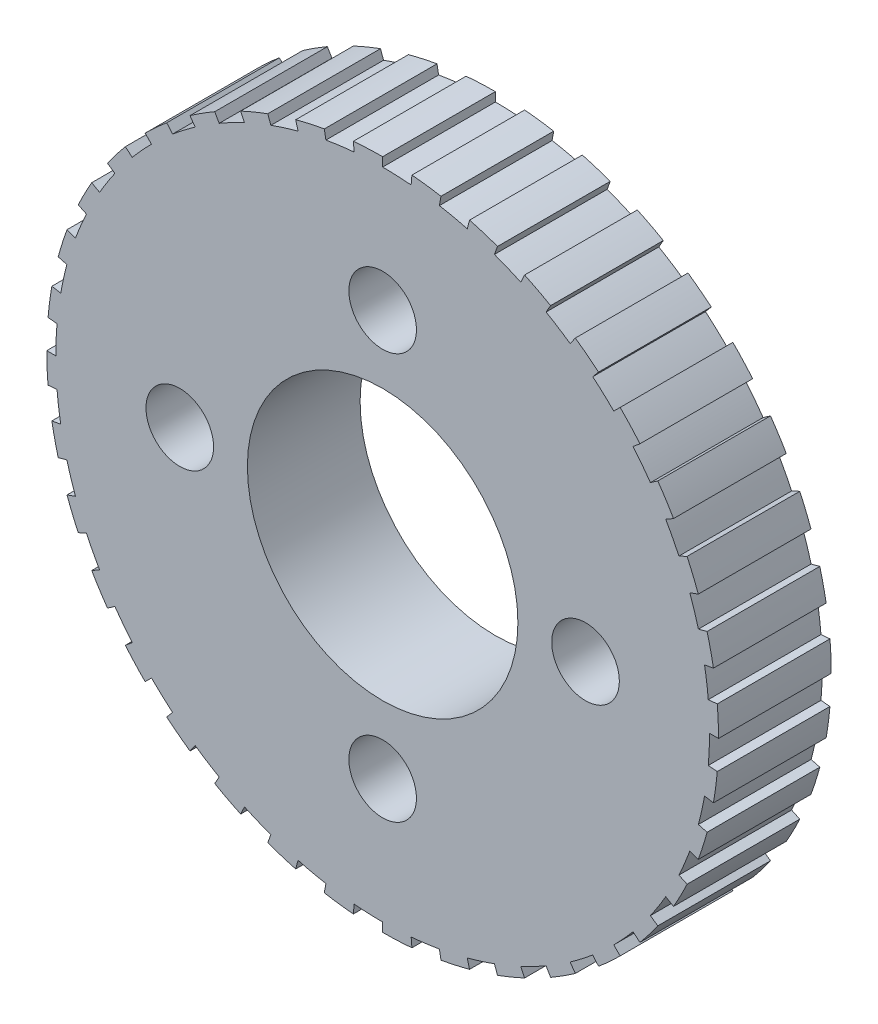
from build123d import *

# Parameters (mm, degrees)
EXTRUDE_1_DEPTH          = 5
EXTRUDE_1_DEPTH_BACK     = 5
SKETCH_1_R               = 12
CUT_EXTRUDE_1_DEPTH      = 10
CUT_EXTRUDE_1_DEPTH_BACK = 10
SKETCH_2_R               = 3


with BuildPart() as part:
    # 草图1 → 凸台-拉伸1 (new, two sides: drawn at the far end of the back side and taken through both)
    with BuildSketch(Plane.XY.offset(-EXTRUDE_1_DEPTH_BACK)):
        with BuildLine():
            Line((28.559424837, -5.035797152), (29.34727104, -5.174715694))
            ThreePointArc((29.34727104, -5.174715694), (29.545056869, -3.889680528), (29.686602003, -2.597241134))
            Line((29.686602003, -2.597241134), (28.889646245, -2.52751654))
            ThreePointArc((28.889646245, -2.52751654), (28.972398426, -1.264962234), (29, 0))
            Line((29, 0), (29.8, 0))
            ThreePointArc((29.8, 0), (29.771637003, 1.299857743), (29.686602003, 2.597241134))
            Line((29.686602003, 2.597241134), (28.889646245, 2.52751654))
            ThreePointArc((28.889646245, 2.52751654), (28.75190098, 3.785259574), (28.559424837, 5.035797152))
            Line((28.559424837, 5.035797152), (29.34727104, 5.174715694))
            ThreePointArc((29.34727104, 5.174715694), (29.093621012, 6.449900495), (28.784589623, 7.712807544))
            Line((28.784589623, 7.712807544), (28.011848962, 7.505752308))
            ThreePointArc((28.011848962, 7.505752308), (27.657791572, 8.720468186), (27.251086003, 9.918584156))
            Line((27.251086003, 9.918584156), (28.002840099, 10.192200271))
            ThreePointArc((28.002840099, 10.192200271), (27.531610069, 11.403966284), (27.007972054, 12.5940242))
            Line((27.007972054, 12.5940242), (26.282925824, 12.25592959))
            ThreePointArc((26.282925824, 12.25592959), (25.723314162, 13.390709784), (25.11473671, 14.5))
            Line((25.11473671, 14.5), (25.807557033, 14.9))
            ThreePointArc((25.807557033, 14.9), (25.133065085, 16.011528329), (24.41073092, 17.092577803))
            Line((24.41073092, 17.092577803), (23.755409284, 16.633716654))
            ThreePointArc((23.755409284, 16.633716654), (23.007246868, 17.654081441), (22.21528885, 18.640840681))
            Line((22.21528885, 18.640840681), (22.828124405, 19.155070769))
            ThreePointArc((22.828124405, 19.155070769), (21.970864637, 20.132588187), (21.071782079, 21.071782079))
            Line((21.071782079, 21.071782079), (20.506096654, 20.506096654))
            ThreePointArc((20.506096654, 20.506096654), (19.592116021, 21.381042767), (18.640840681, 22.21528885))
            Line((18.640840681, 22.21528885), (19.155070769, 22.828124405))
            ThreePointArc((19.155070769, 22.828124405), (18.141090584, 23.641929541), (17.092577803, 24.41073092))
            Line((17.092577803, 24.41073092), (16.633716654, 23.755409284))
            ThreePointArc((16.633716654, 23.755409284), (15.581688642, 24.458351929), (14.5, 25.11473671))
            Line((14.5, 25.11473671), (14.9, 25.807557033))
            ThreePointArc((14.9, 25.807557033), (13.760108674, 26.432922829), (12.5940242, 27.007972054))
            Line((12.5940242, 27.007972054), (12.25592959, 26.282925824))
            ThreePointArc((12.25592959, 26.282925824), (11.097819539, 26.792506443), (9.918584156, 27.251086003))
            Line((9.918584156, 27.251086003), (10.192200271, 28.002840099))
            ThreePointArc((10.192200271, 28.002840099), (8.961032825, 28.420765132), (7.712807544, 28.784589623))
            Line((7.712807544, 28.784589623), (7.505752308, 28.011848962))
            ThreePointArc((7.505752308, 28.011848962), (6.276748804, 28.312584206), (5.035797152, 28.559424837))
            Line((5.035797152, 28.559424837), (5.174715694, 29.34727104))
            ThreePointArc((5.174715694, 29.34727104), (3.889680528, 29.545056869), (2.597241134, 29.686602003))
            Line((2.597241134, 29.686602003), (2.52751654, 28.889646245))
            ThreePointArc((2.52751654, 28.889646245), (1.264962234, 28.972398426), (0, 29))
            Line((0, 29), (0, 29.8))
            ThreePointArc((0, 29.8), (-1.299857743, 29.771637003), (-2.597241134, 29.686602003))
            Line((-2.597241134, 29.686602003), (-2.52751654, 28.889646245))
            ThreePointArc((-2.52751654, 28.889646245), (-3.785259574, 28.75190098), (-5.035797152, 28.559424837))
            Line((-5.035797152, 28.559424837), (-5.174715694, 29.34727104))
            ThreePointArc((-5.174715694, 29.34727104), (-6.449900495, 29.093621012), (-7.712807544, 28.784589623))
            Line((-7.712807544, 28.784589623), (-7.505752308, 28.011848962))
            ThreePointArc((-7.505752308, 28.011848962), (-8.720468186, 27.657791572), (-9.918584156, 27.251086003))
            Line((-9.918584156, 27.251086003), (-10.192200271, 28.002840099))
            ThreePointArc((-10.192200271, 28.002840099), (-11.403966284, 27.531610069), (-12.5940242, 27.007972054))
            Line((-12.5940242, 27.007972054), (-12.25592959, 26.282925824))
            ThreePointArc((-12.25592959, 26.282925824), (-13.390709784, 25.723314162), (-14.5, 25.11473671))
            Line((-14.5, 25.11473671), (-14.9, 25.807557033))
            ThreePointArc((-14.9, 25.807557033), (-16.011528329, 25.133065085), (-17.092577803, 24.41073092))
            Line((-17.092577803, 24.41073092), (-16.633716654, 23.755409284))
            ThreePointArc((-16.633716654, 23.755409284), (-17.654081441, 23.007246868), (-18.640840681, 22.21528885))
            Line((-18.640840681, 22.21528885), (-19.155070769, 22.828124405))
            ThreePointArc((-19.155070769, 22.828124405), (-20.132588187, 21.970864637), (-21.071782079, 21.071782079))
            Line((-21.071782079, 21.071782079), (-20.506096654, 20.506096654))
            ThreePointArc((-20.506096654, 20.506096654), (-21.381042767, 19.592116021), (-22.21528885, 18.640840681))
            Line((-22.21528885, 18.640840681), (-22.828124405, 19.155070769))
            ThreePointArc((-22.828124405, 19.155070769), (-23.641929541, 18.141090584), (-24.41073092, 17.092577803))
            Line((-24.41073092, 17.092577803), (-23.755409284, 16.633716654))
            ThreePointArc((-23.755409284, 16.633716654), (-24.458351929, 15.581688642), (-25.11473671, 14.5))
            Line((-25.11473671, 14.5), (-25.807557033, 14.9))
            ThreePointArc((-25.807557033, 14.9), (-26.432922829, 13.760108674), (-27.007972054, 12.5940242))
            Line((-27.007972054, 12.5940242), (-26.282925824, 12.25592959))
            ThreePointArc((-26.282925824, 12.25592959), (-26.792506443, 11.097819539), (-27.251086003, 9.918584156))
            Line((-27.251086003, 9.918584156), (-28.002840099, 10.192200271))
            ThreePointArc((-28.002840099, 10.192200271), (-28.420765132, 8.961032825), (-28.784589623, 7.712807544))
            Line((-28.784589623, 7.712807544), (-28.011848962, 7.505752308))
            ThreePointArc((-28.011848962, 7.505752308), (-28.312584206, 6.276748804), (-28.559424837, 5.035797152))
            Line((-28.559424837, 5.035797152), (-29.34727104, 5.174715694))
            ThreePointArc((-29.34727104, 5.174715694), (-29.545056869, 3.889680528), (-29.686602003, 2.597241134))
            Line((-29.686602003, 2.597241134), (-28.889646245, 2.52751654))
            ThreePointArc((-28.889646245, 2.52751654), (-28.972398426, 1.264962234), (-29, 0))
            Line((-29, 0), (-29.8, 0))
            ThreePointArc((-29.8, 0), (-29.771637003, -1.299857743), (-29.686602003, -2.597241134))
            Line((-29.686602003, -2.597241134), (-28.889646245, -2.52751654))
            ThreePointArc((-28.889646245, -2.52751654), (-28.75190098, -3.785259574), (-28.559424837, -5.035797152))
            Line((-28.559424837, -5.035797152), (-29.34727104, -5.174715694))
            ThreePointArc((-29.34727104, -5.174715694), (-29.093621012, -6.449900495), (-28.784589623, -7.712807544))
            Line((-28.784589623, -7.712807544), (-28.011848962, -7.505752308))
            ThreePointArc((-28.011848962, -7.505752308), (-27.657791572, -8.720468186), (-27.251086003, -9.918584156))
            Line((-27.251086003, -9.918584156), (-28.002840099, -10.192200271))
            ThreePointArc((-28.002840099, -10.192200271), (-27.531610069, -11.403966284), (-27.007972054, -12.5940242))
            Line((-27.007972054, -12.5940242), (-26.282925824, -12.25592959))
            ThreePointArc((-26.282925824, -12.25592959), (-25.723314162, -13.390709784), (-25.11473671, -14.5))
            Line((-25.11473671, -14.5), (-25.807557033, -14.9))
            ThreePointArc((-25.807557033, -14.9), (-25.133065085, -16.011528329), (-24.41073092, -17.092577803))
            Line((-24.41073092, -17.092577803), (-23.755409284, -16.633716654))
            ThreePointArc((-23.755409284, -16.633716654), (-23.007246868, -17.654081441), (-22.21528885, -18.640840681))
            Line((-22.21528885, -18.640840681), (-22.828124405, -19.155070769))
            ThreePointArc((-22.828124405, -19.155070769), (-21.970864637, -20.132588187), (-21.071782079, -21.071782079))
            Line((-21.071782079, -21.071782079), (-20.506096654, -20.506096654))
            ThreePointArc((-20.506096654, -20.506096654), (-19.592116021, -21.381042767), (-18.640840681, -22.21528885))
            Line((-18.640840681, -22.21528885), (-19.155070769, -22.828124405))
            ThreePointArc((-19.155070769, -22.828124405), (-18.141090584, -23.641929541), (-17.092577803, -24.41073092))
            Line((-17.092577803, -24.41073092), (-16.633716654, -23.755409284))
            ThreePointArc((-16.633716654, -23.755409284), (-15.581688642, -24.458351929), (-14.5, -25.11473671))
            Line((-14.5, -25.11473671), (-14.9, -25.807557033))
            ThreePointArc((-14.9, -25.807557033), (-13.760108674, -26.432922829), (-12.5940242, -27.007972054))
            Line((-12.5940242, -27.007972054), (-12.25592959, -26.282925824))
            ThreePointArc((-12.25592959, -26.282925824), (-11.097819539, -26.792506443), (-9.918584156, -27.251086003))
            Line((-9.918584156, -27.251086003), (-10.192200271, -28.002840099))
            ThreePointArc((-10.192200271, -28.002840099), (-8.961032825, -28.420765132), (-7.712807544, -28.784589623))
            Line((-7.712807544, -28.784589623), (-7.505752308, -28.011848962))
            ThreePointArc((-7.505752308, -28.011848962), (-6.276748804, -28.312584206), (-5.035797152, -28.559424837))
            Line((-5.035797152, -28.559424837), (-5.174715694, -29.34727104))
            ThreePointArc((-5.174715694, -29.34727104), (-3.889680528, -29.545056869), (-2.597241134, -29.686602003))
            Line((-2.597241134, -29.686602003), (-2.52751654, -28.889646245))
            ThreePointArc((-2.52751654, -28.889646245), (-1.264962234, -28.972398426), (0, -29))
            Line((0, -29), (0, -29.8))
            ThreePointArc((0, -29.8), (1.299857743, -29.771637003), (2.597241134, -29.686602003))
            Line((2.597241134, -29.686602003), (2.52751654, -28.889646245))
            ThreePointArc((2.52751654, -28.889646245), (3.785259574, -28.75190098), (5.035797152, -28.559424837))
            Line((5.035797152, -28.559424837), (5.174715694, -29.34727104))
            ThreePointArc((5.174715694, -29.34727104), (6.449900495, -29.093621012), (7.712807544, -28.784589623))
            Line((7.712807544, -28.784589623), (7.505752308, -28.011848962))
            ThreePointArc((7.505752308, -28.011848962), (8.720468186, -27.657791572), (9.918584156, -27.251086003))
            Line((9.918584156, -27.251086003), (10.192200271, -28.002840099))
            ThreePointArc((10.192200271, -28.002840099), (11.403966284, -27.531610069), (12.5940242, -27.007972054))
            Line((12.5940242, -27.007972054), (12.25592959, -26.282925824))
            ThreePointArc((12.25592959, -26.282925824), (13.390709784, -25.723314162), (14.5, -25.11473671))
            Line((14.5, -25.11473671), (14.9, -25.807557033))
            ThreePointArc((14.9, -25.807557033), (16.011528329, -25.133065085), (17.092577803, -24.41073092))
            Line((17.092577803, -24.41073092), (16.633716654, -23.755409284))
            ThreePointArc((16.633716654, -23.755409284), (17.654081441, -23.007246868), (18.640840681, -22.21528885))
            Line((18.640840681, -22.21528885), (19.155070769, -22.828124405))
            ThreePointArc((19.155070769, -22.828124405), (20.132588187, -21.970864637), (21.071782079, -21.071782079))
            Line((21.071782079, -21.071782079), (20.506096654, -20.506096654))
            ThreePointArc((20.506096654, -20.506096654), (21.381042767, -19.592116021), (22.21528885, -18.640840681))
            Line((22.21528885, -18.640840681), (22.828124405, -19.155070769))
            ThreePointArc((22.828124405, -19.155070769), (23.641929541, -18.141090584), (24.41073092, -17.092577803))
            Line((24.41073092, -17.092577803), (23.755409284, -16.633716654))
            ThreePointArc((23.755409284, -16.633716654), (24.458351929, -15.581688642), (25.11473671, -14.5))
            Line((25.11473671, -14.5), (25.807557033, -14.9))
            ThreePointArc((25.807557033, -14.9), (26.432922829, -13.760108674), (27.007972054, -12.5940242))
            Line((27.007972054, -12.5940242), (26.282925824, -12.25592959))
            ThreePointArc((26.282925824, -12.25592959), (26.792506443, -11.097819539), (27.251086003, -9.918584156))
            Line((27.251086003, -9.918584156), (28.002840099, -10.192200271))
            ThreePointArc((28.002840099, -10.192200271), (28.420765132, -8.961032825), (28.784589623, -7.712807544))
            Line((28.784589623, -7.712807544), (28.011848962, -7.505752308))
            ThreePointArc((28.011848962, -7.505752308), (28.312584206, -6.276748804), (28.559424837, -5.035797152))
        make_face()
        Circle(SKETCH_1_R, mode=Mode.SUBTRACT)
    extrude(amount=EXTRUDE_1_DEPTH + EXTRUDE_1_DEPTH_BACK)

    # 草图2 → 切除-拉伸1 (cut, two sides: drawn at the far end of the back side and taken through both)
    with BuildSketch(Plane.XY.offset(-CUT_EXTRUDE_1_DEPTH_BACK)):
        with Locations((18, 0)):
            Circle(SKETCH_2_R)
        with Locations((0, -18)):
            Circle(SKETCH_2_R)
        with Locations((-18, 0)):
            Circle(SKETCH_2_R)
        with Locations((0, 18)):
            Circle(SKETCH_2_R)
    extrude(amount=CUT_EXTRUDE_1_DEPTH + CUT_EXTRUDE_1_DEPTH_BACK, mode=Mode.SUBTRACT)


solid = part.part
